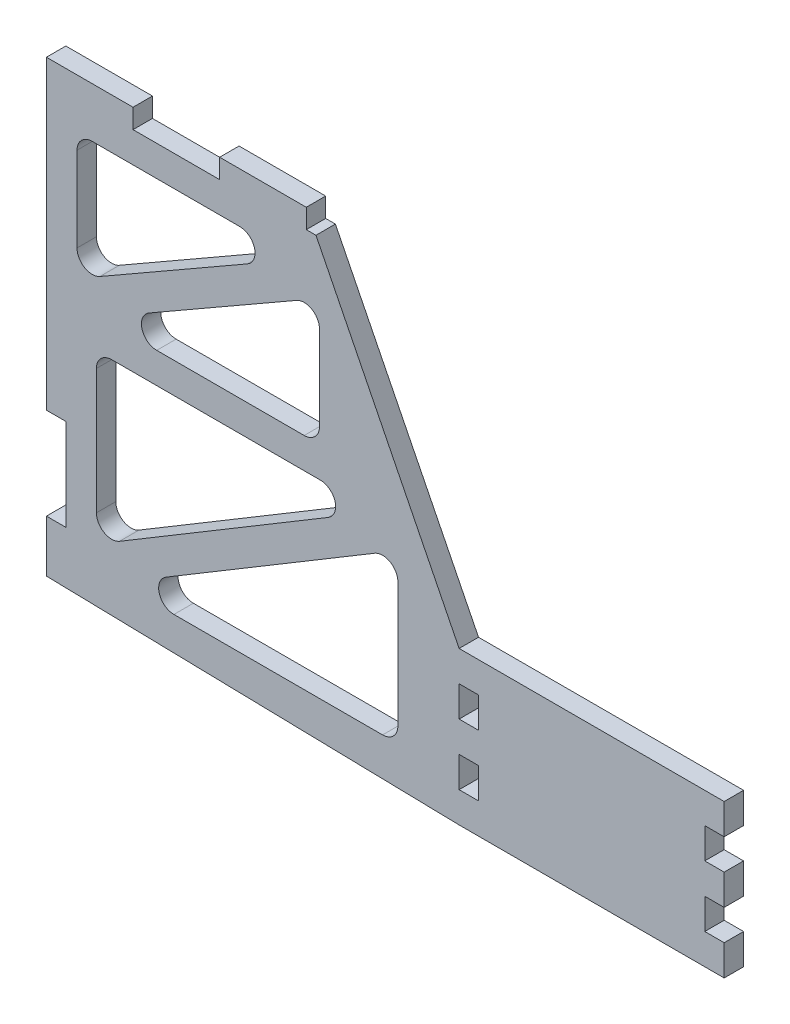
from build123d import *

# Parameters (mm, degrees)
BODY_DEPTH               = 6.35
CROSS_SUPPORT_REACH      = 170.123
SKETCH2_W                = 6.35
SKETCH2_H                = 30
SIDE_SUPPORTS_REACH      = 170.123
SKETCH3_W                = 6.35
SKETCH3_H                = 10
TOP_MOUNTING_TEETH_REACH = 170.123
SKETCH4_W                = 28.333333334
SKETCH4_H                = 6.35
LIGHTNING_HOLES_REACH    = 170.123


with BuildPart() as part:
    # Sketch1 → Body (new body)
    with BuildSketch(Plane.XY):
        Polygon((86.7, -50), (86.7, 0), (0, 0), (-50, 100), (-135, 100), (-135, -47), (0, -50), align=None)
    extrude(amount=BODY_DEPTH)

    # Sketch2 → Cross support (cut, up to next)
    with BuildSketch(Plane.XY.offset(6.35), mode=Mode.PRIVATE) as cross_support_sk1:
        with Locations((-131.825, -15)):
            Rectangle(SKETCH2_W, SKETCH2_H)
    cross_support_tool1 = extrude(cross_support_sk1.sketch, amount=-CROSS_SUPPORT_REACH, mode=Mode.PRIVATE) & part.part
    add(cross_support_tool1.solids().sort_by_distance((-131.825, -15, 6.35))[0], mode=Mode.SUBTRACT)

    # Sketch3 → Side supports (cut, up to next)
    with BuildSketch(Plane.XY.offset(6.35), mode=Mode.PRIVATE) as side_supports_sk1:
        with Locations((83.525, -15)):
            Rectangle(SKETCH3_W, SKETCH3_H)
    side_supports_tool1 = extrude(side_supports_sk1.sketch, amount=-SIDE_SUPPORTS_REACH, mode=Mode.PRIVATE) & part.part
    # Sketch3 → Side supports (cut, up to next)
    with BuildSketch(Plane.XY.offset(6.35), mode=Mode.PRIVATE) as side_supports_sk2:
        with Locations((83.525, -35)):
            Rectangle(SKETCH3_W, SKETCH3_H)
    side_supports_tool2 = extrude(side_supports_sk2.sketch, amount=-SIDE_SUPPORTS_REACH, mode=Mode.PRIVATE) & part.part
    # Sketch3 → Side supports (cut, up to next)
    with BuildSketch(Plane.XY.offset(6.35), mode=Mode.PRIVATE) as side_supports_sk3:
        with Locations((3.175, -35)):
            Rectangle(SKETCH3_W, SKETCH3_H)
    side_supports_tool3 = extrude(side_supports_sk3.sketch, amount=-SIDE_SUPPORTS_REACH, mode=Mode.PRIVATE) & part.part
    # Sketch3 → Side supports (cut, up to next)
    with BuildSketch(Plane.XY.offset(6.35), mode=Mode.PRIVATE) as side_supports_sk4:
        with Locations((3.175, -15)):
            Rectangle(SKETCH3_W, SKETCH3_H)
    side_supports_tool4 = extrude(side_supports_sk4.sketch, amount=-SIDE_SUPPORTS_REACH, mode=Mode.PRIVATE) & part.part
    add(side_supports_tool1.solids().sort_by_distance((83.525, -15, 6.35))[0], mode=Mode.SUBTRACT)
    add(side_supports_tool2.solids().sort_by_distance((83.525, -35, 6.35))[0], mode=Mode.SUBTRACT)
    add(side_supports_tool3.solids().sort_by_distance((3.175, -35, 6.35))[0], mode=Mode.SUBTRACT)
    add(side_supports_tool4.solids().sort_by_distance((3.175, -15, 6.35))[0], mode=Mode.SUBTRACT)

    # Sketch4 → Top mounting teeth (cut, up to next)
    with BuildSketch(Plane.XY.offset(6.35), mode=Mode.PRIVATE) as top_mounting_teeth_sk1:
        with Locations((-92.5, 96.825)):
            Rectangle(SKETCH4_W, SKETCH4_H)
    top_mounting_teeth_tool1 = extrude(top_mounting_teeth_sk1.sketch, amount=-TOP_MOUNTING_TEETH_REACH, mode=Mode.PRIVATE) & part.part
    # Sketch4 → Top mounting teeth (cut, up to next)
    with BuildSketch(Plane.XY.offset(6.35), mode=Mode.PRIVATE) as top_mounting_teeth_sk2:
        Polygon((-46.825, 93.65), (-50, 93.65), (-50, 100), align=None)
    top_mounting_teeth_tool2 = extrude(top_mounting_teeth_sk2.sketch, amount=-TOP_MOUNTING_TEETH_REACH, mode=Mode.PRIVATE) & part.part
    add(top_mounting_teeth_tool1.solids().sort_by_distance((-92.5, 96.825, 6.35))[0], mode=Mode.SUBTRACT)
    add(top_mounting_teeth_tool2.solids().sort_by_distance((-48.941667, 95.766667, 6.35))[0], mode=Mode.SUBTRACT)

    # Sketch6 → Lightning holes (cut, up to next)
    with BuildSketch(Plane.XY.offset(6.35), mode=Mode.PRIVATE) as lightning_holes_sk1:
        with BuildLine():
            Line((-118.65, 20), (-118.65, -20.886138472))
            ThreePointArc((-118.65, -20.886138472), (-116.114979028, -25.236296905), (-111.080448644, -25.175358194))
            Line((-111.080448644, -25.175358194), (-42.831323725, 15.710780278))
            ThreePointArc((-42.831323725, 15.710780278), (-40.581845168, 21.333023141), (-45.400875081, 25))
            Line((-45.400875081, 25), (-113.65, 25))
            ThreePointArc((-113.65, 25), (-117.185533906, 23.535533906), (-118.65, 20))
        make_face()
    lightning_holes_tool1 = extrude(lightning_holes_sk1.sketch, amount=-LIGHTNING_HOLES_REACH, mode=Mode.PRIVATE) & part.part
    # Sketch6 → Lightning holes (cut, up to next)
    with BuildSketch(Plane.XY.offset(6.35), mode=Mode.PRIVATE) as lightning_holes_sk2:
        with BuildLine():
            Line((-93.284496967, -37), (-25.035372048, -37))
            ThreePointArc((-25.035372048, -37), (-21.499838142, -35.535533906), (-20.035372048, -32))
            Line((-20.035372048, -32), (-20.035372048, 8.886138472))
            ThreePointArc((-20.035372048, 8.886138472), (-22.57039302, 13.236296905), (-27.604923404, 13.175358194))
            Line((-27.604923404, 13.175358194), (-95.854048323, -27.710780278))
            ThreePointArc((-95.854048323, -27.710780278), (-98.10352688, -33.333023141), (-93.284496967, -37))
        make_face()
    lightning_holes_tool2 = extrude(lightning_holes_sk2.sketch, amount=-LIGHTNING_HOLES_REACH, mode=Mode.PRIVATE) & part.part
    # Sketch6 → Lightning holes (cut, up to next)
    with BuildSketch(Plane.XY.offset(6.35), mode=Mode.PRIVATE) as lightning_holes_sk3:
        with BuildLine():
            Line((-125, 50.960581269), (-125, 78.65))
            ThreePointArc((-125, 78.65), (-123.535533906, 82.185533906), (-120, 83.65))
            Line((-120, 83.65), (-71.760111312, 83.65))
            ThreePointArc((-71.760111312, 83.65), (-66.928855022, 79.938007244), (-69.271034073, 74.313585064))
            Line((-69.271034073, 74.313585064), (-117.510922761, 46.624166333))
            ThreePointArc((-117.510922761, 46.624166333), (-122.505455428, 46.633608529), (-125, 50.960581269))
        make_face()
    lightning_holes_tool3 = extrude(lightning_holes_sk3.sketch, amount=-LIGHTNING_HOLES_REACH, mode=Mode.PRIVATE) & part.part
    # Sketch6 → Lightning holes (cut, up to next)
    with BuildSketch(Plane.XY.offset(6.35), mode=Mode.PRIVATE) as lightning_holes_sk4:
        with BuildLine():
            Line((-101.408826755, 44.336414936), (-53.168938067, 72.025833667))
            ThreePointArc((-53.168938067, 72.025833667), (-48.1744054, 72.016391471), (-45.679860828, 67.689418731))
            Line((-45.679860828, 67.689418731), (-45.679860828, 40))
            ThreePointArc((-45.679860828, 40), (-47.144326922, 36.464466094), (-50.679860828, 35))
            Line((-50.679860828, 35), (-98.919749516, 35))
            ThreePointArc((-98.919749516, 35), (-103.751005806, 38.711992756), (-101.408826755, 44.336414936))
        make_face()
    lightning_holes_tool4 = extrude(lightning_holes_sk4.sketch, amount=-LIGHTNING_HOLES_REACH, mode=Mode.PRIVATE) & part.part
    add(lightning_holes_tool1.solids().sort_by_distance((-89.16746, 6.594151, 6.35))[0], mode=Mode.SUBTRACT)
    add(lightning_holes_tool2.solids().sort_by_distance((-49.517912, -18.594151, 6.35))[0], mode=Mode.SUBTRACT)
    add(lightning_holes_tool3.solids().sort_by_distance((-102.306081, 69.637212, 6.35))[0], mode=Mode.SUBTRACT)
    add(lightning_holes_tool4.solids().sort_by_distance((-68.37378, 49.012788, 6.35))[0], mode=Mode.SUBTRACT)


solid = part.part
